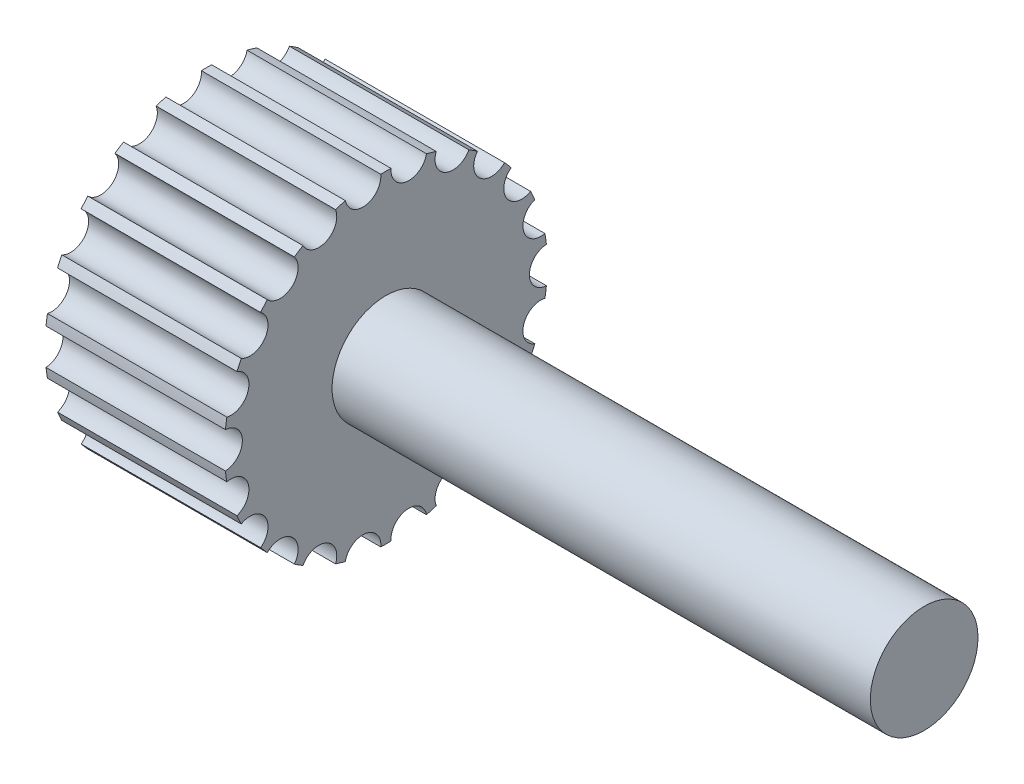
from build123d import *

# Parameters (mm, degrees)
SKETCH1_R           = 4.5
BOSS_EXTRUDE1_DEPTH = 5
SKETCH2_R           = 1.5
BOSS_EXTRUDE2_DEPTH = 20
SKETCH3_R           = 0.5
CUT_EXTRUDE2_DEPTH  = 5
CIRPATTERN1_COUNT   = 22


with BuildPart() as part:
    # Sketch1 → Boss-Extrude1 (new body)
    with BuildSketch(Plane(origin=(0, 0, 0), x_dir=(0, 0, -1), z_dir=(1, 0, 0))):
        Circle(SKETCH1_R)
    extrude(amount=BOSS_EXTRUDE1_DEPTH)

    # Sketch2 → Boss-Extrude2 (add)
    with BuildSketch(Plane(origin=(0, 0, 0), x_dir=(0, 0, -1), z_dir=(1, 0, 0))):
        Circle(SKETCH2_R)
    extrude(amount=BOSS_EXTRUDE2_DEPTH)

    # Sketch3 → Cut-Extrude2 (cut, symmetric)
    with BuildSketch(Plane(origin=(0, 0, 0), x_dir=(0, 0, -1), z_dir=(1, 0, 0))):
        with Locations((4.5, 0)):
            Circle(SKETCH3_R)
    cut_extrude2 = extrude(amount=CUT_EXTRUDE2_DEPTH, both=True, mode=Mode.SUBTRACT)

    # CirPattern1: Cut-Extrude2 ×22 about axis
    cirpattern1_axis = Axis((-1, 0, 0), (1, 0, 0))
    for i in range(1, CIRPATTERN1_COUNT):
        add(cut_extrude2.rotate(cirpattern1_axis, i * 360 / CIRPATTERN1_COUNT), mode=Mode.SUBTRACT)


solid = part.part
